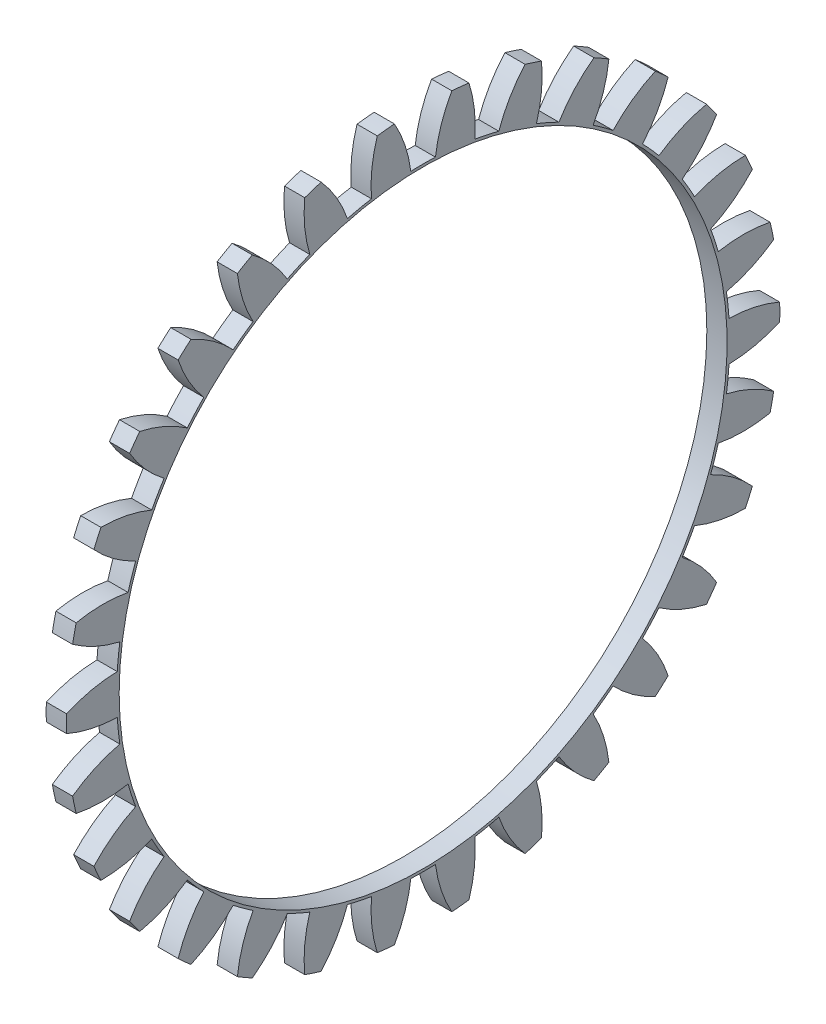
from build123d import *

# Parameters (mm, degrees)
BASPROSKE_W     = 5
BASPROSKE_H     = 88
TOOTHCUT_DEPTH  = 125.551194294
TEETHCUTS_COUNT = 30
TEETHCUTS_ANGLE = 348
BORSKE_R        = 75
BORE_DEPTH      = 50.0000508


with BuildPart() as part:
    # BasProSke → Base-Revolve (revolve)
    with BuildSketch(Plane(origin=(0, 0, 0), x_dir=(1, 0, 0), z_dir=(0, 1, 0)), mode=Mode.PRIVATE) as base_revolve_sk:
        with Locations((2.5, 44)):
            Rectangle(BASPROSKE_W, BASPROSKE_H)
    revolve(base_revolve_sk.sketch.rotate(Axis((-10, 0, 0), (1, 0, 0)), 180), axis=Axis((-10, 0, 0), (1, 0, 0)))

    # TooCutSke → ToothCut (cut, through all)
    with BuildSketch(Plane(origin=(0, 0, 0), x_dir=(0, 0, -1), z_dir=(1, 0, 0))):
        with BuildLine():
            ThreePointArc((3.035113553, 75.56306943), (0, 75.624), (-3.035113553, 75.56306943))
            ThreePointArc((-3.035113553, 75.56306943), (-4.467122645, 81.850310375), (-7.094453994, 87.739043576))
            ThreePointArc((-7.094453994, 87.739043576), (0, 88.0254), (7.094453994, 87.739043576))
            ThreePointArc((7.094453994, 87.739043576), (4.467122645, 81.850310375), (3.035113553, 75.56306943))
        make_face()
    toothcut = extrude(amount=TOOTHCUT_DEPTH, mode=Mode.SUBTRACT)

    # TeethCuts: ToothCut ×30 about axis
    teethcuts_axis = Axis((-10, 0, 0), (1, 0, 0))
    for i in range(1, TEETHCUTS_COUNT):
        add(toothcut.rotate(teethcuts_axis, i * TEETHCUTS_ANGLE / (TEETHCUTS_COUNT - 1)), mode=Mode.SUBTRACT)

    # BorSke → Bore (cut, symmetric)
    with BuildSketch(Plane(origin=(0, 0, 0), x_dir=(0, 0, -1), z_dir=(1, 0, 0))):
        with Locations(Location((0, 0, 0), (0, 0, 180))):
            Circle(BORSKE_R)
    extrude(amount=BORE_DEPTH, both=True, mode=Mode.SUBTRACT)


solid = part.part
